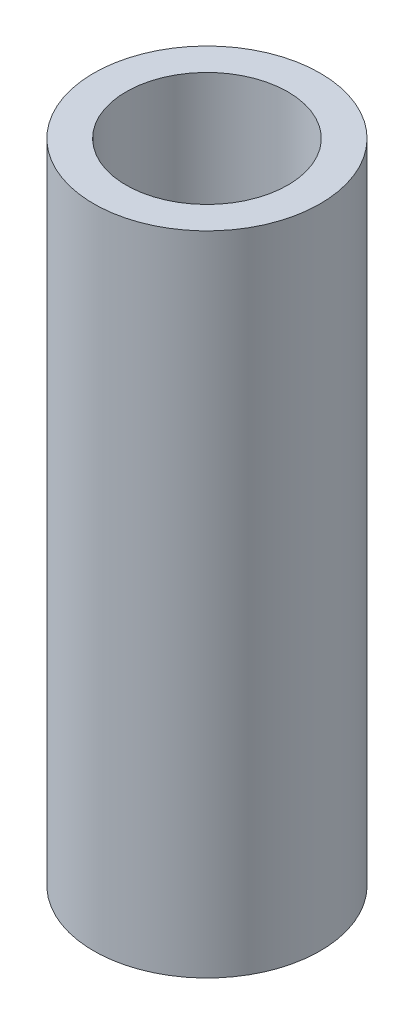
from build123d import *

# Parameters (mm, degrees)
SKETCH1_W = 1.27
SKETCH1_H = 25.4


with BuildPart() as part:
    # Sketch1 → Revolve1 (revolve)
    with BuildSketch(Plane.XY, mode=Mode.PRIVATE) as revolve1_sk:
        with Locations((3.81, 12.7)):
            Rectangle(SKETCH1_W, SKETCH1_H)
    revolve(revolve1_sk.sketch.rotate(Axis((0, 0, 0), (0, 1, 0)), 90), axis=Axis((0, 0, 0), (0, 1, 0)))


solid = part.part
